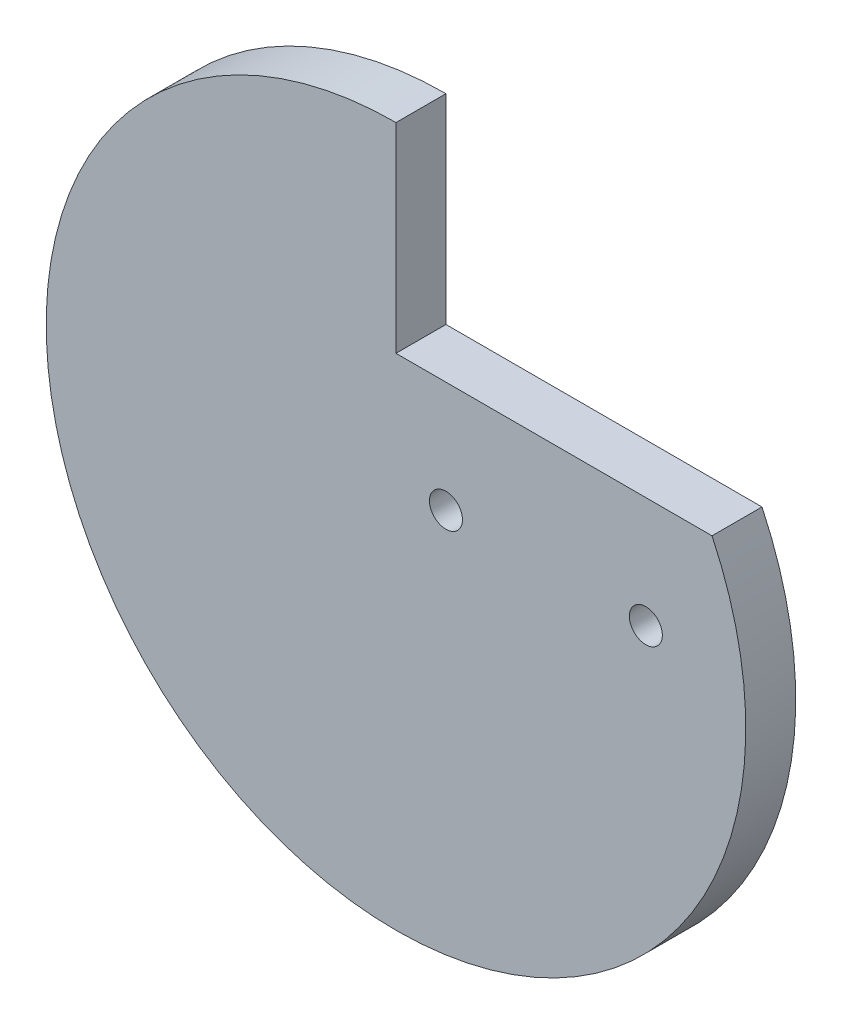
from build123d import *

# Parameters (mm, degrees)
SKETCH2_R           = 35
BOSS_EXTRUDE1_DEPTH = 5
SKETCH4_R           = 1.65
SKETCH4_W           = 60
SKETCH4_H           = 20
CUT_EXTRUDE1_DEPTH  = 5


with BuildPart() as part:
    # Sketch2 → Boss-Extrude1 (new body)
    with BuildSketch(Plane.XY):
        Circle(SKETCH2_R)
    extrude(amount=BOSS_EXTRUDE1_DEPTH)

    # Sketch4 → Cut-Extrude1 (cut)
    with BuildSketch(Plane.XY.offset(5)):
        with Locations((5, 3.9)):
            Circle(SKETCH4_R)
        with Locations((25, 3.9)):
            Circle(SKETCH4_R)
        with Locations((30, 25)):
            Rectangle(SKETCH4_W, SKETCH4_H)
    extrude(amount=-CUT_EXTRUDE1_DEPTH, mode=Mode.SUBTRACT)


solid = part.part
